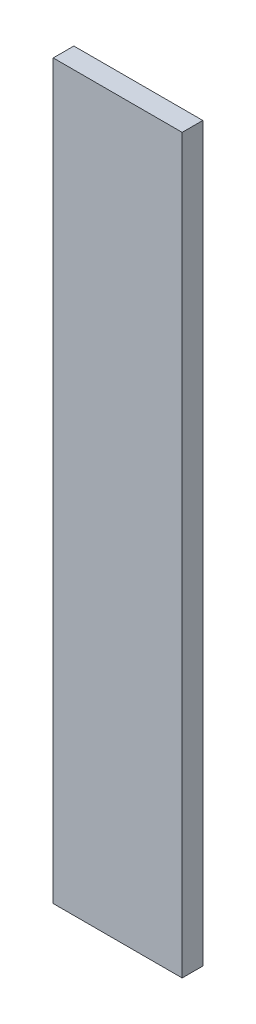
from build123d import *

# Parameters (mm, degrees)
ESQUISSE1_W        = 50
ESQUISSE1_H        = 284
BOSS_EXTRU_1_DEPTH = 8


with BuildPart() as part:
    # Esquisse1 → Boss.-Extru.1 (new body)
    with BuildSketch(Plane.XY):
        with Locations((25, 142)):
            Rectangle(ESQUISSE1_W, ESQUISSE1_H)
    extrude(amount=BOSS_EXTRU_1_DEPTH)


solid = part.part
